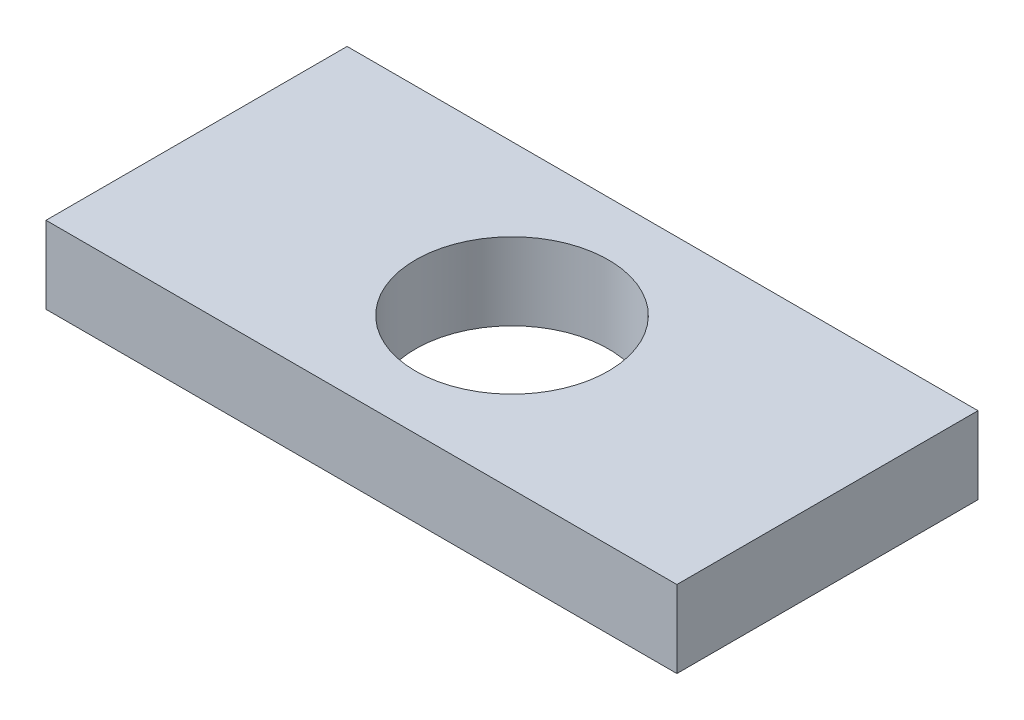
from build123d import *

# Parameters (mm, degrees)
SKETCH1_W           = 83.104478008
SKETCH1_H           = 39.663500868
SKETCH1_R           = 12.7
BOSS_EXTRUDE1_DEPTH = 10.16


with BuildPart() as part:
    # Sketch1 → Boss-Extrude1 (new body)
    with BuildSketch(Plane(origin=(0, 0, 0), x_dir=(1, 0, 0), z_dir=(0, 1, 0))):
        Rectangle(SKETCH1_W, SKETCH1_H)
        with Locations(Location((0, 0, 0), (0, 0, 270))):
            Circle(SKETCH1_R, mode=Mode.SUBTRACT)
    extrude(amount=BOSS_EXTRUDE1_DEPTH)


solid = part.part
